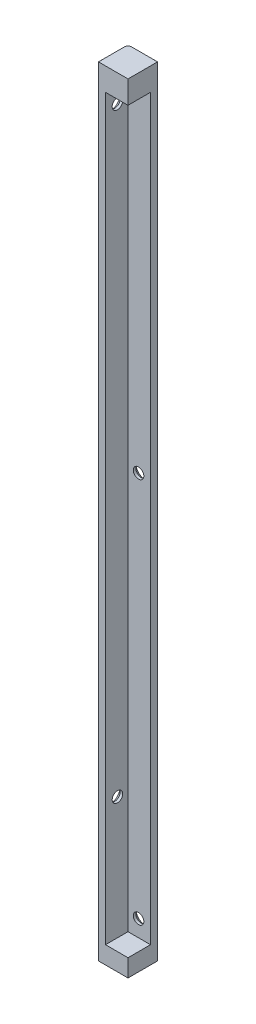
from build123d import *

# Parameters (mm, degrees)
BOSS_EXTRUDE1_DEPTH                                 = 221.5
CSK_FOR_M3_COUNTERSUNK_FLAT_HEAD_SCREW1_D           = 3
CSK_FOR_M3_COUNTERSUNK_FLAT_HEAD_SCREW1_CSINK_D     = 5.5
CSK_FOR_M3_COUNTERSUNK_FLAT_HEAD_SCREW1_CSINK_ANGLE = 90
CSK_FOR_M3_COUNTERSUNK_FLAT_HEAD_SCREW4_D           = 3
CSK_FOR_M3_COUNTERSUNK_FLAT_HEAD_SCREW4_CSINK_D     = 5.5
CSK_FOR_M3_COUNTERSUNK_FLAT_HEAD_SCREW4_CSINK_ANGLE = 90
SKETCH12_W                                          = 8
SKETCH12_H                                          = 7
BOSS_EXTRUDE2_DEPTH                                 = 5.5
CUT_EXTRUDE1_DEPTH                                  = 359
BOSS_EXTRUDE3_DEPTH                                 = 3
BOSS_EXTRUDE4_DEPTH                                 = 2.5
BOSS_EXTRUDE4_DEPTH_BACK                            = 6
SKETCH19_W                                          = 0.6
SKETCH19_H                                          = 227
CUT_EXTRUDE2_DEPTH                                  = 10
SKETCH20_W                                          = 15.604741464
SKETCH20_H                                          = 2
CUT_EXTRUDE3_DEPTH                                  = 10
SKETCH21_W                                          = 0.6
SKETCH21_H                                          = 225
CUT_EXTRUDE4_DEPTH                                  = 10
SKETCH22_W                                          = 8.4
SKETCH22_H                                          = 5.5
CUT_EXTRUDE5_DEPTH                                  = 10
BOSS_EXTRUDE5_DEPTH                                 = 2
BOSS_EXTRUDE6_DEPTH                                 = 221.5
FILLET1_R                                           = 1


with BuildPart() as part:
    # Sketch1 → Boss-Extrude1 (new body)
    with BuildSketch(Plane(origin=(0, 0, 0), x_dir=(1, 0, 0), z_dir=(0, 1, 0))):
        Polygon((0, 0), (0, 9), (9, 9), (9, 7), (2, 7), (2, 0), align=None)
    extrude(amount=BOSS_EXTRUDE1_DEPTH)

    # CSK for M3 Countersunk Flat Head Screw1 (through all)
    with Locations(Plane.ZY):
        with Locations((-4, 211), (-4, 40.25)):
            CounterSinkHole(CSK_FOR_M3_COUNTERSUNK_FLAT_HEAD_SCREW1_D / 2, CSK_FOR_M3_COUNTERSUNK_FLAT_HEAD_SCREW1_CSINK_D / 2, counter_sink_angle=CSK_FOR_M3_COUNTERSUNK_FLAT_HEAD_SCREW1_CSINK_ANGLE)

    # CSK for M3 Countersunk Flat Head Screw4 (through all)
    with Locations(Plane(origin=(0, 0, -9), x_dir=(-1, 0, 0), z_dir=(0, 0, -1))):
        with Locations((-5, 10.25), (-5, 120)):
            CounterSinkHole(CSK_FOR_M3_COUNTERSUNK_FLAT_HEAD_SCREW4_D / 2, CSK_FOR_M3_COUNTERSUNK_FLAT_HEAD_SCREW4_CSINK_D / 2, counter_sink_angle=CSK_FOR_M3_COUNTERSUNK_FLAT_HEAD_SCREW4_CSINK_ANGLE)

    # Sketch12 → Boss-Extrude2 (add)
    with BuildSketch(Plane.XZ):
        with Locations((5, -3.5)):
            Rectangle(SKETCH12_W, SKETCH12_H)
    extrude(amount=-BOSS_EXTRUDE2_DEPTH)

    # Sketch13 → Cut-Extrude1 (cut)
    with BuildSketch(Plane(origin=(0, 221.5, 0), x_dir=(1, 0, 0), z_dir=(0, 1, 0))):
        Polygon((0, 8), (1, 9), (0, 9), align=None)
    extrude(amount=-CUT_EXTRUDE1_DEPTH, mode=Mode.SUBTRACT)

    # Sketch14 → Boss-Extrude3 (add)
    with BuildSketch(Plane.XZ):
        Polygon((0, 0), (9, 0), (9, -9), (1, -9), (0, -8), align=None)
    extrude(amount=BOSS_EXTRUDE3_DEPTH)

    # Sketch18 → Boss-Extrude4 (add, two sides: drawn at the far end of the back side and taken through both)
    with BuildSketch(Plane(origin=(0, 221.5, 0), x_dir=(1, 0, 0), z_dir=(0, 1, 0)).offset(-BOSS_EXTRUDE4_DEPTH_BACK)):
        Polygon((0, 0), (9, 0), (9, 9), (1, 9), (0, 8), align=None)
    extrude(amount=BOSS_EXTRUDE4_DEPTH + BOSS_EXTRUDE4_DEPTH_BACK)

    # Sketch19 → Cut-Extrude2 (cut)
    with BuildSketch(Plane.ZY):
        with Locations((-0.3, 110.5)):
            Rectangle(SKETCH19_W, SKETCH19_H)
    extrude(amount=-CUT_EXTRUDE2_DEPTH, mode=Mode.SUBTRACT)

    # Sketch20 → Cut-Extrude3 (cut)
    with BuildSketch(Plane.ZY):
        with Locations((-8.402370732, 223)):
            Rectangle(SKETCH20_W, SKETCH20_H)
    extrude(amount=-CUT_EXTRUDE3_DEPTH, mode=Mode.SUBTRACT)

    # Sketch21 → Cut-Extrude4 (cut)
    with BuildSketch(Plane(origin=(0, 0, -9), x_dir=(-1, 0, 0), z_dir=(0, 0, -1))):
        with Locations((-8.7, 109.5)):
            Rectangle(SKETCH21_W, SKETCH21_H)
    extrude(amount=-CUT_EXTRUDE4_DEPTH, mode=Mode.SUBTRACT)

    # Sketch22 → Cut-Extrude5 (cut)
    with BuildSketch(Plane(origin=(0, 0, -9), x_dir=(-1, 0, 0), z_dir=(0, 0, -1))):
        with Locations((-4.2, -0.25)):
            Rectangle(SKETCH22_W, SKETCH22_H)
    extrude(amount=-CUT_EXTRUDE5_DEPTH, mode=Mode.SUBTRACT)

    # Sketch26 → Boss-Extrude5 (add)
    with BuildSketch(Plane.XZ.offset(-2.5)):
        Polygon((8.4, -9), (8.4, -0.6), (0, -0.6), (0, -8), (1, -9), align=None)
    extrude(amount=BOSS_EXTRUDE5_DEPTH)

    # Sketch29 → Boss-Extrude6 (add)
    with BuildSketch(Plane(origin=(0, 222, 0), x_dir=(1, 0, 0), z_dir=(0, 1, 0))):
        Polygon((0, 8), (1, 9), (0, 9), align=None)
    extrude(amount=-BOSS_EXTRUDE6_DEPTH)

    # Fillet1
    fillet1_edges = [part.edges().sort_by_distance(p)[0] for p in [
        (0, 111.25, -9),
    ]]
    fillet(fillet1_edges, radius=FILLET1_R)


solid = part.part
